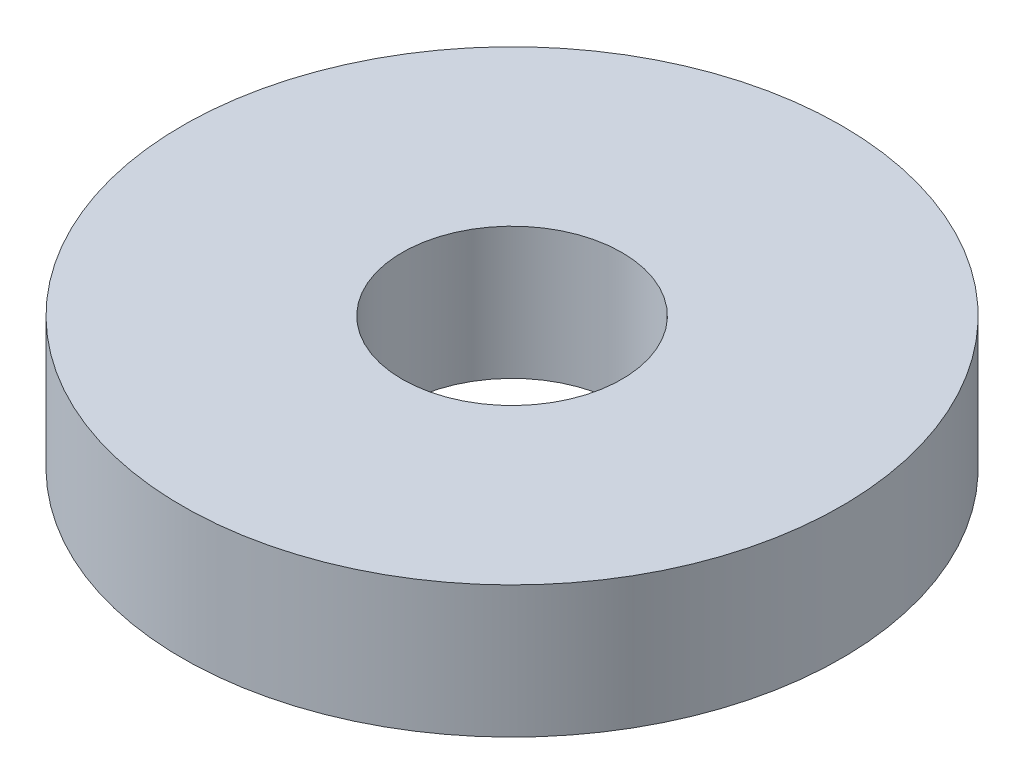
from build123d import *

# Parameters (mm, degrees)
SKETCH1_W = 10
SKETCH1_H = 6


with BuildPart() as part:
    # Sketch1 → Revolve1 (revolve)
    with BuildSketch(Plane.XY, mode=Mode.PRIVATE) as revolve1_sk:
        with Locations((-10, 0.067184557)):
            Rectangle(SKETCH1_W, SKETCH1_H)
    revolve(revolve1_sk.sketch.rotate(Axis((0, 0, 0), (0, 1, 0)), 270), axis=Axis((0, 0, 0), (0, 1, 0)))


solid = part.part
